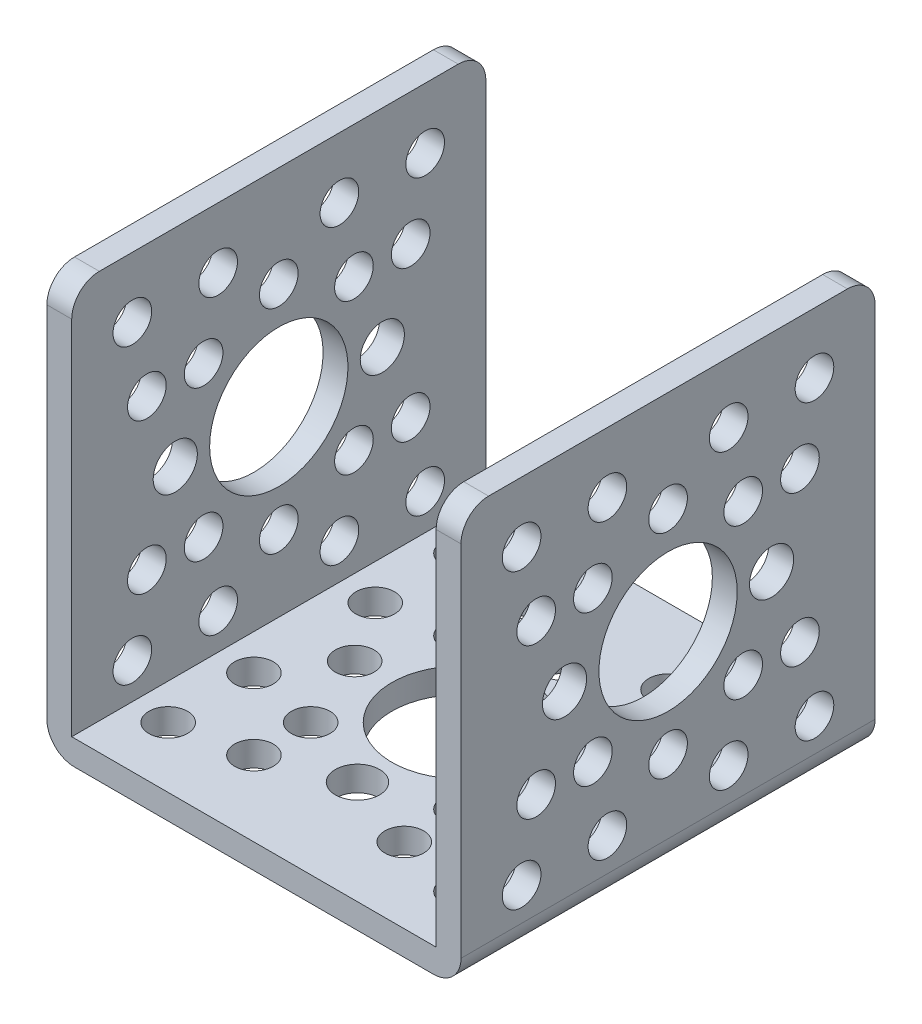
from build123d import *

# Parameters (mm, degrees)
SKETCH1_W                 = 38.1
SKETCH1_H                 = 38.1
BOSS_EXTRUDE1_DEPTH       = 38.1
SKETCH2_W                 = 33.528
SKETCH2_H                 = 35.814
CUT_EXTRUDE1_DEPTH        = 66.991135768
HOLE1_D                   = 12.7254
HOLE1_DEPTH               = 2.286
F_6_CLEARANCE_HOLE1_D     = 4.064
F_6_CLEARANCE_HOLE1_DEPTH = 2.286
F_5_CLEARANCE_HOLE1_D     = 3.556
F_5_CLEARANCE_HOLE1_DEPTH = 2.286
HOLE2_D                   = 12.7254
HOLE2_DEPTH               = 38.1
F_6_CLEARANCE_HOLE2_D     = 4.064
F_6_CLEARANCE_HOLE2_DEPTH = 38.1
F_5_CLEARANCE_HOLE2_D     = 3.556
F_5_CLEARANCE_HOLE2_DEPTH = 38.1
HOLE3_D                   = 12.7254
HOLE3_DEPTH               = 38.1
F_6_CLEARANCE_HOLE3_D     = 4.064
F_6_CLEARANCE_HOLE3_DEPTH = 38.1
F_5_CLEARANCE_HOLE3_D     = 3.556
F_5_CLEARANCE_HOLE3_DEPTH = 38.1
FILLET1_R                 = 2.54


with BuildPart() as part:
    # Sketch1 → Boss-Extrude1 (new body)
    with BuildSketch(Plane(origin=(38.1, 0, 0), x_dir=(0, 0, -1), z_dir=(1, 0, 0))):
        with Locations((-19.05, 19.05)):
            Rectangle(SKETCH1_W, SKETCH1_H)
    extrude(amount=-BOSS_EXTRUDE1_DEPTH)

    # Sketch2 → Cut-Extrude1 (cut, through all)
    with BuildSketch(Plane.XY.offset(38.1)):
        with Locations((19.05, 20.193)):
            Rectangle(SKETCH2_W, SKETCH2_H)
    extrude(amount=-CUT_EXTRUDE1_DEPTH, mode=Mode.SUBTRACT)

    # Hole1
    with Locations(Plane.ZY):
        with Locations((19.05, 19.05)):
            Hole(HOLE1_D / 2, depth=HOLE1_DEPTH)

    # #6 Clearance Hole1
    with Locations(Plane.ZY):
        with Locations((28.575, 19.05), (9.525, 19.05)):
            Hole(F_6_CLEARANCE_HOLE1_D / 2, depth=F_6_CLEARANCE_HOLE1_DEPTH)

    # #5 Clearance Hole1
    with Locations(Plane.ZY):
        with Locations((24.629615818, 5.579615818), (31.185202787, 12.135202787), (24.629615818, 32.520384182), (31.185202787, 25.964797213), (13.470384182, 5.579615818), (6.914797213, 12.135202787), (13.470384182, 32.520384182), (6.914797213, 25.964797213), (32.520384182, 5.579615818), (32.520384182, 32.520384182), (5.579615818, 5.579615818), (5.579615818, 32.520384182), (12.135202787, 12.135202787), (19.05, 9.271), (25.964797213, 12.135202787), (25.964797213, 25.964797213), (19.05, 28.829), (12.135202787, 25.964797213)):
            Hole(F_5_CLEARANCE_HOLE1_D / 2, depth=F_5_CLEARANCE_HOLE1_DEPTH)

    # Hole2
    with Locations(Plane(origin=(0, 0, 0), x_dir=(-1, 0, 0), z_dir=(0, -1, 0))):
        with Locations((-19.05, -19.05)):
            Hole(HOLE2_D / 2, depth=HOLE2_DEPTH)

    # #6 Clearance Hole2
    with Locations(Plane(origin=(0, 0, 0), x_dir=(-1, 0, 0), z_dir=(0, -1, 0))):
        with Locations((-19.05, -28.575), (-19.05, -9.525)):
            Hole(F_6_CLEARANCE_HOLE2_D / 2, depth=F_6_CLEARANCE_HOLE2_DEPTH)

    # #5 Clearance Hole2
    with Locations(Plane(origin=(0, 0, 0), x_dir=(-1, 0, 0), z_dir=(0, -1, 0))):
        with Locations((-5.579615818, -32.520384182), (-5.579615818, -24.629615818), (-12.135202787, -31.185202787), (-32.520384182, -32.520384182), (-32.520384182, -24.629615818), (-25.964797213, -31.185202787), (-5.579615818, -5.579615818), (-5.579615818, -13.470384182), (-12.135202787, -6.914797213), (-32.520384182, -5.579615818), (-32.520384182, -13.470384182), (-25.964797213, -6.914797213), (-12.135202787, -12.135202787), (-9.271, -19.05), (-12.135202787, -25.964797213), (-25.964797213, -25.964797213), (-28.829, -19.05), (-25.964797213, -12.135202787)):
            Hole(F_5_CLEARANCE_HOLE2_D / 2, depth=F_5_CLEARANCE_HOLE2_DEPTH)

    # Hole3
    with Locations(Plane(origin=(38.1, 0, 0), x_dir=(0, 0, -1), z_dir=(1, 0, 0))):
        with Locations((-19.05, 19.05)):
            Hole(HOLE3_D / 2, depth=HOLE3_DEPTH)

    # #6 Clearance Hole3
    with Locations(Plane(origin=(38.1, 0, 0), x_dir=(0, 0, -1), z_dir=(1, 0, 0))):
        with Locations((-28.575, 19.05), (-9.525, 19.05)):
            Hole(F_6_CLEARANCE_HOLE3_D / 2, depth=F_6_CLEARANCE_HOLE3_DEPTH)

    # #5 Clearance Hole3
    with Locations(Plane(origin=(38.1, 0, 0), x_dir=(0, 0, -1), z_dir=(1, 0, 0))):
        with Locations((-31.185202787, 12.135202787), (-31.185202787, 25.964797213), (-6.914797213, 12.135202787), (-13.470384182, 32.520384182), (-6.914797213, 25.964797213), (-32.520384182, 5.579615818), (-32.520384182, 32.520384182), (-5.579615818, 5.579615818), (-5.579615818, 32.520384182), (-12.135202787, 12.135202787), (-19.05, 9.271), (-25.964797213, 12.135202787), (-25.964797213, 25.964797213), (-19.05, 28.829), (-12.135202787, 25.964797213), (-13.470384182, 5.579615818), (-24.629615818, 32.520384182), (-24.629615818, 5.579615818)):
            Hole(F_5_CLEARANCE_HOLE3_D / 2, depth=F_5_CLEARANCE_HOLE3_DEPTH)

    # Fillet1
    fillet1_edges = [part.edges().sort_by_distance(p)[0] for p in [
        (0, 0, 19.05),
        (36.957, 38.1, 0),
        (36.957, 38.1, 38.1),
        (38.1, 0, 19.05),
        (1.143, 38.1, 38.1),
        (1.143, 38.1, 0),
    ]]
    fillet(fillet1_edges, radius=FILLET1_R)


solid = part.part
